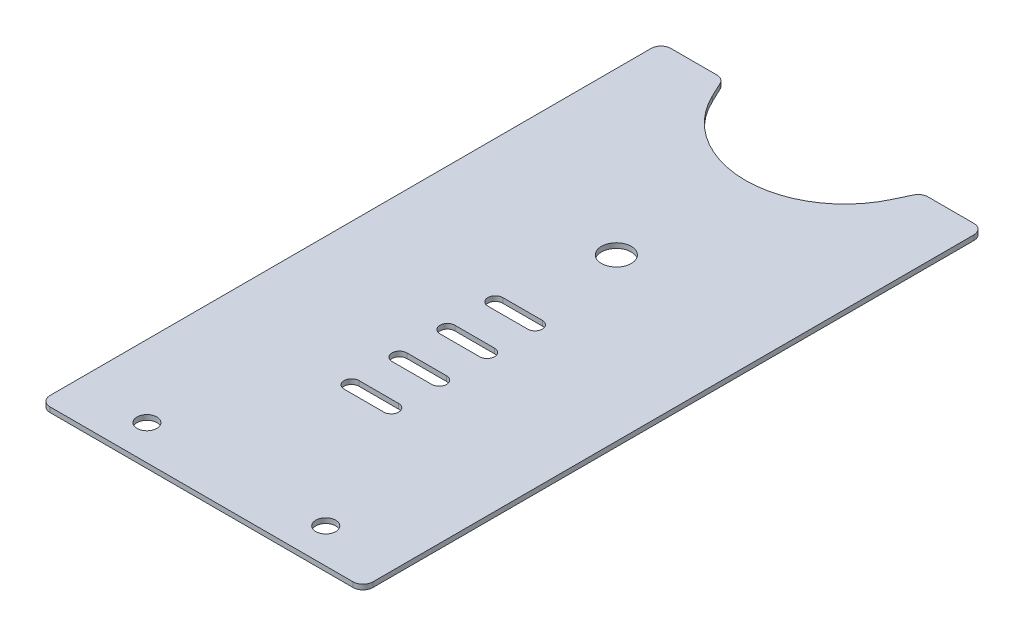
from build123d import *

# Parameters (mm, degrees)
SKETCH_1_R      = 2
SKETCH_1_R_2    = 3
EXTRUDE_1_DEPTH = 1
FILLET_1_R      = 2


with BuildPart() as part:
    # 草图1 → Extrude 1 (new body)
    with BuildSketch(Plane(origin=(0, 0, 0), x_dir=(1, 0, 0), z_dir=(0, 1, 0))):
        with BuildLine():
            Line((-18.072575848, 120.933670434), (-20, 125))
            Line((-20, 125), (-32.5, 125))
            Line((-32.5, 125), (-32.5, 0))
            Line((-32.5, 0), (32.5, 0))
            Line((32.5, 0), (32.5, 125))
            Line((32.5, 125), (20, 125))
            Line((20, 125), (18.072575848, 120.933670434))
            ThreePointArc((18.072575848, 120.933670434), (0, 109.5), (-18.072575848, 120.933670434))
        make_face()
        with Locations((-18, 7)):
            Circle(SKETCH_1_R, mode=Mode.SUBTRACT)
        with Locations((18, 7)):
            Circle(SKETCH_1_R, mode=Mode.SUBTRACT)
        with Locations((0, 83.51)):
            Circle(SKETCH_1_R_2, mode=Mode.SUBTRACT)
        with BuildLine():
            Line((-4, 35.690566512), (4, 35.690566512))
            ThreePointArc((4, 35.690566512), (5.5, 34.190566512), (4, 32.690566512))
            Line((4, 32.690566512), (-4, 32.690566512))
            ThreePointArc((-4, 32.690566512), (-5.5, 34.190566512), (-4, 35.690566512))
        make_face(mode=Mode.SUBTRACT)
        with BuildLine():
            Line((-4, 45.340566355), (4, 45.340566355))
            ThreePointArc((4, 45.340566355), (5.5, 43.840566355), (4, 42.340566355))
            Line((4, 42.340566355), (-4, 42.340566355))
            ThreePointArc((-4, 42.340566355), (-5.5, 43.840566355), (-4, 45.340566355))
        make_face(mode=Mode.SUBTRACT)
        with BuildLine():
            Line((-4, 54.990566199), (4, 54.990566199))
            ThreePointArc((4, 54.990566199), (5.5, 53.490566199), (4, 51.990566199))
            Line((4, 51.990566199), (-4, 51.990566199))
            ThreePointArc((-4, 51.990566199), (-5.5, 53.490566199), (-4, 54.990566199))
        make_face(mode=Mode.SUBTRACT)
        with BuildLine():
            Line((-4, 64.640566042), (4, 64.640566042))
            ThreePointArc((4, 64.640566042), (5.5, 63.140566042), (4, 61.640566042))
            Line((4, 61.640566042), (-4, 61.640566042))
            ThreePointArc((-4, 61.640566042), (-5.5, 63.140566042), (-4, 64.640566042))
        make_face(mode=Mode.SUBTRACT)
    extrude(amount=EXTRUDE_1_DEPTH)

    # 圆角1
    fillet_1_edges = [part.edges().sort_by_distance(p)[0] for p in [
        (20, 0.5, -125),
        (32.5, 0.5, -125),
        (-20, 0.5, -125),
        (-32.5, 0.5, 0),
        (-32.5, 0.5, -125),
        (32.5, 0.5, 0),
    ]]
    fillet(fillet_1_edges, radius=FILLET_1_R)


solid = part.part
